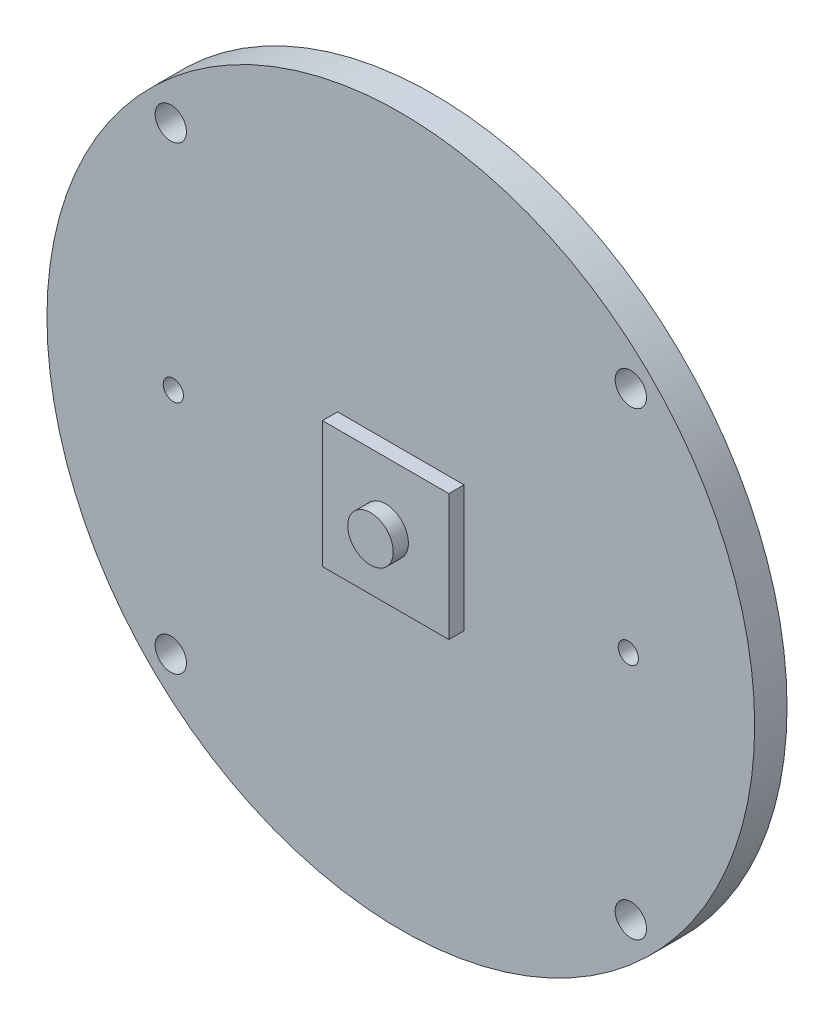
from build123d import *

# Parameters (mm, degrees)
SKETCH1_R           = 17.78
BOSS_EXTRUDE1_DEPTH = 1.6256
SKETCH2_R           = 0.508
CUT_EXTRUDE1_DEPTH  = 26.197209674
SKETCH3_W           = 6.35
SKETCH3_H           = 6.35
BOSS_EXTRUDE2_DEPTH = 0.762
SKETCH4_R           = 1.143
BOSS_EXTRUDE3_DEPTH = 0.762
SKETCH5_R           = 0.7874
CUT_EXTRUDE2_DEPTH  = 26.197209674


with BuildPart() as part:
    # Sketch1 → Boss-Extrude1 (new body)
    with BuildSketch(Plane.XY):
        Circle(SKETCH1_R)
    extrude(amount=BOSS_EXTRUDE1_DEPTH)

    # Sketch2 → Cut-Extrude1 (cut, through all)
    with BuildSketch(Plane.XY.offset(1.6256)):
        with Locations((-11.43, 0)):
            Circle(SKETCH2_R)
        with Locations((11.43, 0)):
            Circle(SKETCH2_R)
    extrude(amount=-CUT_EXTRUDE1_DEPTH, mode=Mode.SUBTRACT)

    # Sketch3 → Boss-Extrude2 (add)
    with BuildSketch(Plane.XY.offset(1.6256)):
        Rectangle(SKETCH3_W, SKETCH3_H)
    extrude(amount=BOSS_EXTRUDE2_DEPTH)

    # Sketch4 → Boss-Extrude3 (add)
    with BuildSketch(Plane.XY.offset(2.3876)):
        with Locations(Location((0, 0, 0), (0, 0, 180))):
            Circle(SKETCH4_R)
    extrude(amount=BOSS_EXTRUDE3_DEPTH)

    # Sketch5 → Cut-Extrude2 (cut, through all)
    with BuildSketch(Plane.XY.offset(1.6256)):
        with Locations((-11.557, 11.557)):
            Circle(SKETCH5_R)
        with Locations((11.557, 11.557)):
            Circle(SKETCH5_R)
        with Locations((11.557, -11.557)):
            Circle(SKETCH5_R)
        with Locations((-11.557, -11.557)):
            Circle(SKETCH5_R)
    extrude(amount=-CUT_EXTRUDE2_DEPTH, mode=Mode.SUBTRACT)


solid = part.part
